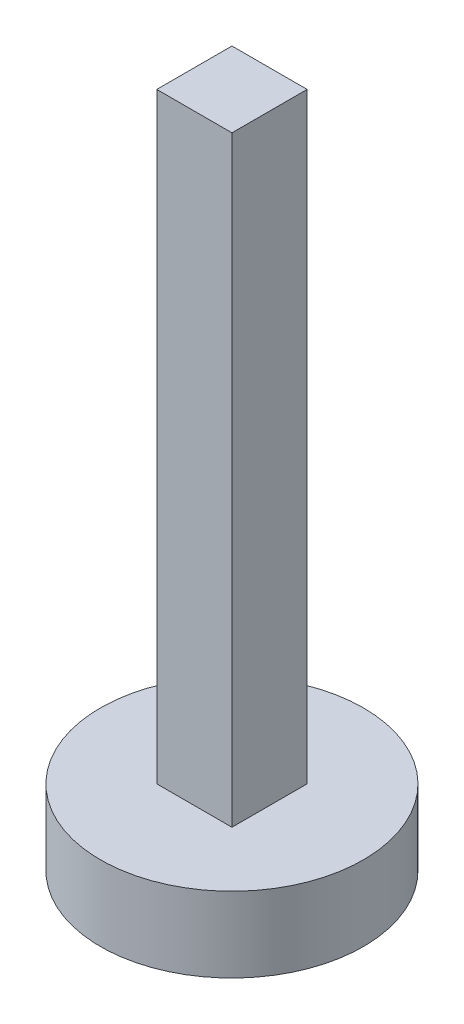
from build123d import *

# Parameters (mm, degrees)
SKETCH_1_W      = 10
SKETCH_1_H      = 10
EXTRUDE_1_DEPTH = 80
SKETCH_2_R      = 17.5
EXTRUDE_2_DEPTH = 10


with BuildPart() as part:
    # 草图1 → 凸台-拉伸1 (new body)
    with BuildSketch(Plane(origin=(0, 0, 0), x_dir=(1, 0, 0), z_dir=(0, 1, 0))):
        Rectangle(SKETCH_1_W, SKETCH_1_H)
    extrude(amount=EXTRUDE_1_DEPTH)

    # 草图2 → 凸台-拉伸2 (add)
    with BuildSketch(Plane.XZ):
        with Locations(Location((0, 0, 0), (0, 0, 270))):
            Circle(SKETCH_2_R)
    extrude(amount=EXTRUDE_2_DEPTH)


solid = part.part
